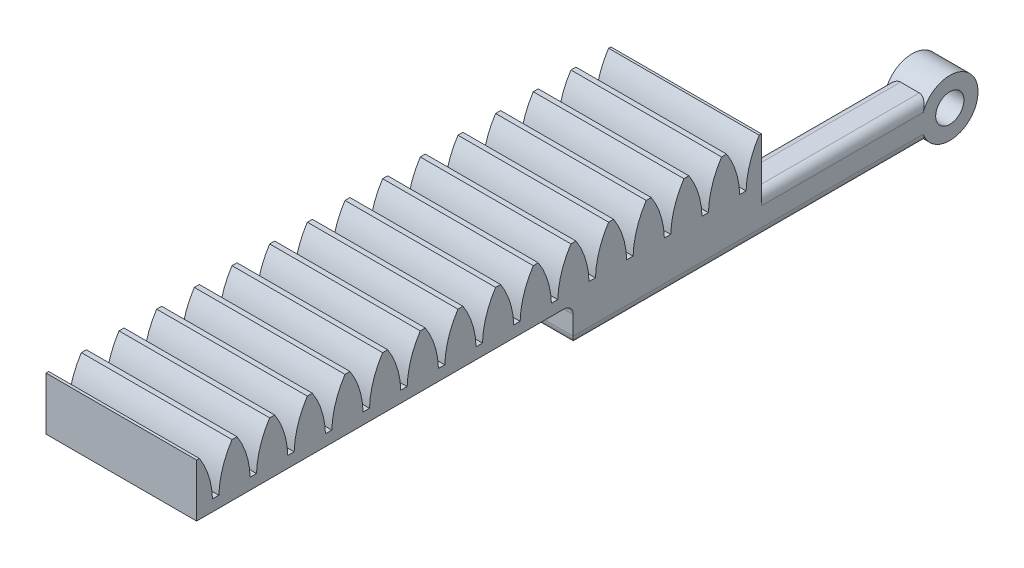
from build123d import *

# Parameters (mm, degrees)
SKETCH1_W                       = 2
SKETCH1_H                       = 2
BOSS_EXTRUDE1_DEPTH             = 20
BOSS_EXTRUDE2_REACH             = 22.05
SKETCH2_R                       = 1.5
BOSS_EXTRUDE2_DIRECTION_2_REACH = 22.05
CUT_EXTRUDE1_DEPTH              = 21.081085628
CUT_EXTRUDE1_DEPTH_BACK         = 21.081085628
SKETCH3_R                       = 0.75
SKETCH4_W                       = 8
SKETCH4_H                       = 30
BOSS_EXTRUDE4_DEPTH             = 2.81
CUT_EXTRUDE3_DEPTH              = 41.78622439
LPATTERN1_COUNT                 = 14
LPATTERN1_PITCH                 = 2
LPATTERN1_COL_COUNT             = 2
LPATTERN1_COL_PITCH             = 2
FILLET2_R                       = 0.5


with BuildPart() as part:
    # Sketch1 → Boss-Extrude1 (new body)
    with BuildSketch(Plane.XY):
        Rectangle(SKETCH1_W, SKETCH1_H)
    extrude(amount=BOSS_EXTRUDE1_DEPTH)

    # Boss-Extrude2: up to this face of the body (flat: up to its plane)
    boss_extrude2_end = Plane(part.part.faces().sort_by_distance((1, 0, 10))[0])
    # Sketch2 → Boss-Extrude2 (add, up to the picked face)
    with BuildSketch(Plane(origin=(0, 0, 0), x_dir=(0, 0, -1), z_dir=(1, 0, 0)), mode=Mode.PRIVATE) as boss_extrude2_sk1:
        Circle(SKETCH2_R)
    boss_extrude2_tool1 = split(extrude(boss_extrude2_sk1.sketch, amount=BOSS_EXTRUDE2_REACH, mode=Mode.PRIVATE), bisect_by=boss_extrude2_end, keep=Keep.BOTH, mode=Mode.PRIVATE)
    add(boss_extrude2_tool1.solids().sort_by(Axis((0, 0, 0), (1, 0, 0)))[0])

    # Boss-Extrude2 direction 2: up to this face of the body (flat: up to its plane)
    boss_extrude2_direction_2_end = Plane(part.part.faces().sort_by_distance((-1, 0, 10))[0])
    # Sketch2 → Boss-Extrude2 direction 2 (add, up to the picked face)
    with BuildSketch(Plane(origin=(0, 0, 0), x_dir=(0, 0, -1), z_dir=(1, 0, 0)), mode=Mode.PRIVATE) as boss_extrude2_direction_2_sk1:
        Circle(SKETCH2_R)
    boss_extrude2_direction_2_tool1 = split(extrude(boss_extrude2_direction_2_sk1.sketch, amount=-BOSS_EXTRUDE2_DIRECTION_2_REACH, mode=Mode.PRIVATE), bisect_by=boss_extrude2_direction_2_end, keep=Keep.BOTH, mode=Mode.PRIVATE)
    add(boss_extrude2_direction_2_tool1.solids().sort_by(Axis((0, 0, 0), (-1, 0, 0)))[0])

    # Sketch3 → Cut-Extrude1 (cut, two sides: drawn at the far end of the back side and taken through both)
    with BuildSketch(Plane(origin=(0, 0, 0), x_dir=(0, 0, -1), z_dir=(1, 0, 0)).offset(-CUT_EXTRUDE1_DEPTH_BACK)):
        Circle(SKETCH3_R)
    extrude(amount=CUT_EXTRUDE1_DEPTH + CUT_EXTRUDE1_DEPTH_BACK, mode=Mode.SUBTRACT)

    # Sketch4 → Boss-Extrude4 (add)
    with BuildSketch(Plane(origin=(0, 1, 0), x_dir=(1, 0, 0), z_dir=(0, 1, 0))):
        with Locations((-3, -25)):
            Rectangle(SKETCH4_W, SKETCH4_H)
    extrude(amount=BOSS_EXTRUDE4_DEPTH)

    # Sketch9 → Cut-Extrude3 (cut, symmetric)
    with BuildSketch(Plane(origin=(0, 0, 0), x_dir=(0, 0, -1), z_dir=(1, 0, 0))):
        with BuildLine():
            ThreePointArc((-38.315329673, 4.397253742), (-37.483653354, 3.101788083), (-37.158231048, 1.597122972))
            ThreePointArc((-37.158231048, 1.597122972), (-36.989658323, 1.6), (-36.821085598, 1.597122972))
            ThreePointArc((-36.821085598, 1.597122972), (-36.495663293, 3.101788083), (-35.663986973, 4.397253742))
            ThreePointArc((-35.663986973, 4.397253742), (-36.989658323, 4.51), (-38.315329673, 4.397253742))
        make_face()
    cut_extrude3 = extrude(amount=CUT_EXTRUDE3_DEPTH, both=True, mode=Mode.SUBTRACT)

    # LPattern1: Cut-Extrude3 ×14
    with Locations(*[(0, 0, -i * LPATTERN1_PITCH) for i in range(1, LPATTERN1_COUNT)]):
        add(cut_extrude3, mode=Mode.SUBTRACT)

    # LPattern1 col: Cut-Extrude3 ×2
    with Locations(*[(0, 0, i * LPATTERN1_COL_PITCH) for i in range(1, LPATTERN1_COL_COUNT)]):
        add(cut_extrude3, mode=Mode.SUBTRACT)

    # Fillet2
    fillet2_edges = [part.edges().sort_by_distance(p)[0] for p in [
        (-1, -1, 10.559016994),
        (1, -1, 10.559016994),
        (1, 1, 5.559016994),
        (-1, 1, 5.559016994),
        (0, -1, 20),
        (0, 1, 20),
    ]]
    fillet(fillet2_edges, radius=FILLET2_R)


solid = part.part
